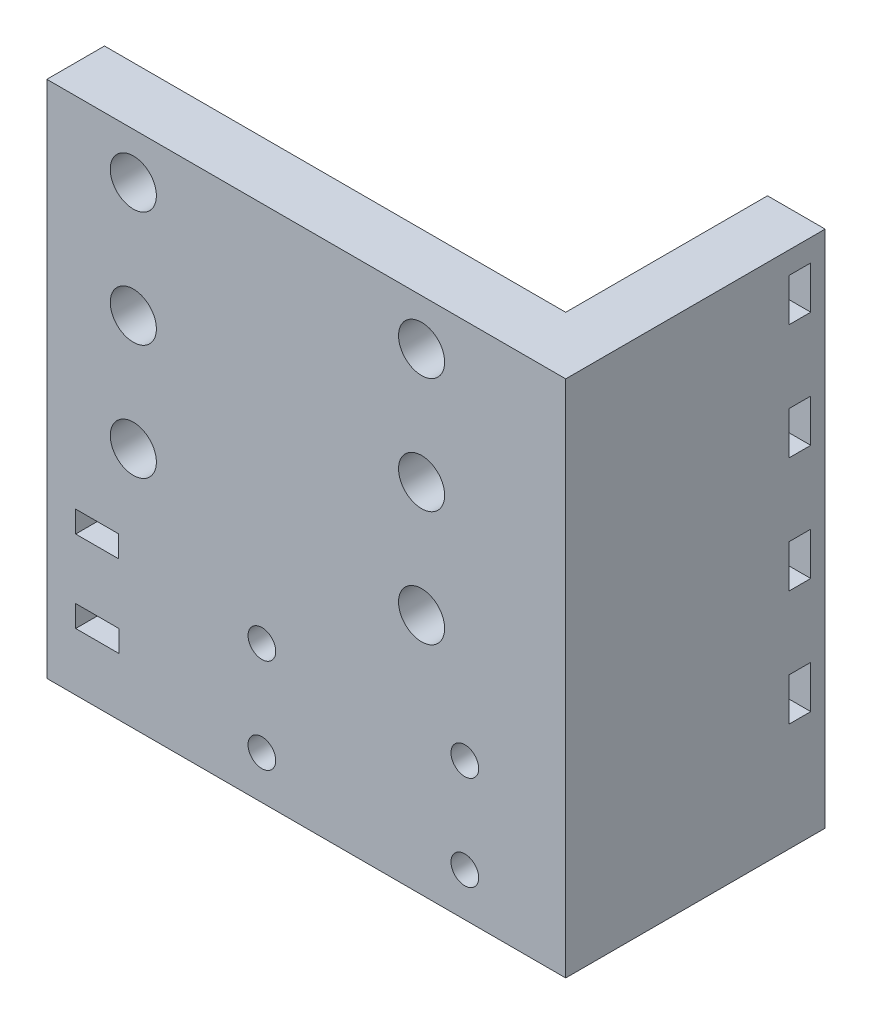
from build123d import *

# Parameters (mm, degrees)
SKETCH1_W           = 50.8
SKETCH1_H           = 57.15
BOSS_EXTRUDE1_DEPTH = 6.35
SKETCH5_R           = 1.524
SKETCH5_R_2         = 2.54
CUT_EXTRUDE1_DEPTH  = 72.447438113
SKETCH6_W           = 4.7625
SKETCH6_H           = 2.38125
SKETCH6_W_2         = 4.700923451
CUT_EXTRUDE2_DEPTH  = 72.447438113
SKETCH9_W           = 28.575
SKETCH9_H           = 57.15
BOSS_EXTRUDE2_DEPTH = 6.35
SKETCH11_W          = 2.38252
SKETCH11_H          = 4.70154
CUT_EXTRUDE4_DEPTH  = 75.015666563
LPATTERN1_COUNT     = 4
LPATTERN1_PITCH     = 12.7


with BuildPart() as part:
    # Sketch1 → Boss-Extrude1 (new body)
    with BuildSketch(Plane.XY):
        with Locations((-32.446072824, -12.876728212)):
            Rectangle(SKETCH1_W, SKETCH1_H)
    extrude(amount=BOSS_EXTRUDE1_DEPTH)

    # Sketch5 → Cut-Extrude1 (cut, through all)
    with BuildSketch(Plane.XY.offset(6.35)):
        with Locations((-11.808572824, -26.275228212)):
            Circle(SKETCH5_R)
        with Locations((-11.808572824, -36.689228212)):
            Circle(SKETCH5_R)
        with Locations((-34.160572824, -26.275228212)):
            Circle(SKETCH5_R)
        with Locations((-34.160572824, -36.689228212)):
            Circle(SKETCH5_R)
        with Locations((-48.321072824, 10.618271788)):
            Circle(SKETCH5_R_2)
        with Locations((-16.571072824, 10.618271788)):
            Circle(SKETCH5_R_2)
        with Locations((-48.321072824, -2.081728212)):
            Circle(SKETCH5_R_2)
        with Locations((-16.571072824, -2.081728212)):
            Circle(SKETCH5_R_2)
        with Locations((-48.321072824, -14.781728212)):
            Circle(SKETCH5_R_2)
        with Locations((-16.571072824, -14.781728212)):
            Circle(SKETCH5_R_2)
    extrude(amount=-CUT_EXTRUDE1_DEPTH, mode=Mode.SUBTRACT)

    # Sketch6 → Cut-Extrude2 (cut, through all)
    with BuildSketch(Plane.XY.offset(6.35)):
        with Locations((-52.289822824, -33.911103212)):
            Rectangle(SKETCH6_W, SKETCH6_H)
        with Locations((-52.320611099, -24.900183987)):
            Rectangle(SKETCH6_W_2, SKETCH6_H)
    extrude(amount=-CUT_EXTRUDE2_DEPTH, mode=Mode.SUBTRACT)

    # Sketch9 → Boss-Extrude2 (add)
    with BuildSketch(Plane(origin=(-7.046072824, 0, 0), x_dir=(0, 0, -1), z_dir=(1, 0, 0))):
        with Locations((7.9375, -12.876728212)):
            Rectangle(SKETCH9_W, SKETCH9_H)
    extrude(amount=BOSS_EXTRUDE2_DEPTH)

    # Sketch11 → Cut-Extrude4 (cut, through all)
    with BuildSketch(Plane(origin=(-0.696072824, 0, 0), x_dir=(0, 0, -1), z_dir=(1, 0, 0))):
        with Locations((19.44624, 10.915505986)):
            Rectangle(SKETCH11_W, SKETCH11_H)
    cut_extrude4 = extrude(amount=-CUT_EXTRUDE4_DEPTH, mode=Mode.SUBTRACT)

    # LPattern1: Cut-Extrude4 ×4
    with Locations(*[(0, -i * LPATTERN1_PITCH, 0) for i in range(1, LPATTERN1_COUNT)]):
        add(cut_extrude4, mode=Mode.SUBTRACT)


solid = part.part
